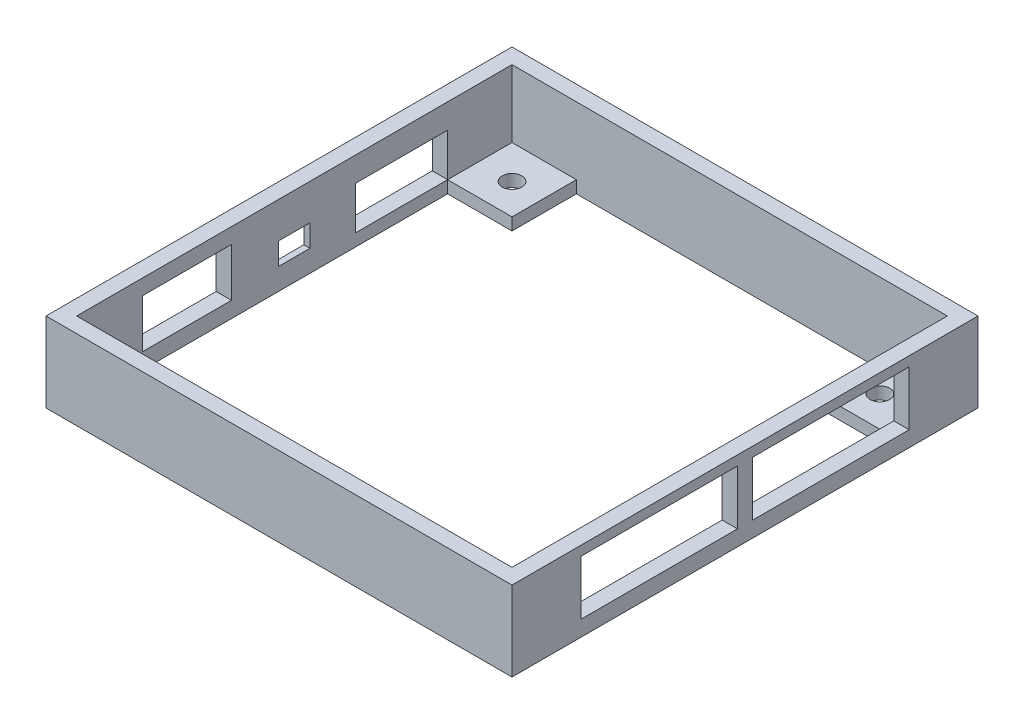
from build123d import *

# Parameters (mm, degrees)
SKETCH_1_W                  = 76
SKETCH_1_H                  = 76
EXTRUDE_1_DEPTH             = 13
SKETCH_2_W                  = 71
SKETCH_2_H                  = 71
CUT_EXTRUDE_1_DEPTH         = 11
SKETCH_3_R                  = 1.6
CUT_EXTRUDE_2_DEPTH         = 55.854352608
PATTERN_LINEAR_1_COUNT      = 2
PATTERN_LINEAR_1_PITCH      = 60
PATTERN_LINEAR_1_COUNT_DIR2 = 2
PATTERN_LINEAR_1_PITCH_DIR2 = 60
CUT_EXTRUDE_3_DEPTH         = 55.854352608
CUT_EXTRUDE_5_REACH         = 87.959
SKETCH_5_W                  = 14.5
SKETCH_5_H                  = 7.9
CUT_EXTRUDE_6_REACH         = 87.959
SKETCH_7_W                  = 25.542842713
SKETCH_7_H                  = 8.882842713
CUT_EXTRUDE_7_REACH         = 85.757
SKETCH_8_W                  = 5.1
SKETCH_8_H                  = 3.6
CUT_EXTRUDE_8_REACH         = 85.757
SKETCH_9_W                  = 15
SKETCH_9_H                  = 7
CHAMFER_1_SIZE              = 1.5


with BuildPart() as part:
    # 草图1 → 凸台-拉伸1 (new body)
    with BuildSketch(Plane(origin=(0, 0, 0), x_dir=(1, 0, 0), z_dir=(0, 1, 0))):
        Rectangle(SKETCH_1_W, SKETCH_1_H)
    extrude(amount=EXTRUDE_1_DEPTH)

    # 草图2 → 切除-拉伸1 (cut)
    with BuildSketch(Plane(origin=(0, 13, 0), x_dir=(1, 0, 0), z_dir=(0, 1, 0))):
        Rectangle(SKETCH_2_W, SKETCH_2_H)
    extrude(amount=-CUT_EXTRUDE_1_DEPTH, mode=Mode.SUBTRACT)

    # 草图3 → 切除-拉伸2 (cut, through all)
    with BuildSketch(Plane(origin=(0, 2, 0), x_dir=(1, 0, 0), z_dir=(0, 1, 0))):
        with Locations(Location((-30, 30, 0), (0, 0, 270))):
            Circle(SKETCH_3_R)
    cut_extrude_2 = extrude(amount=-CUT_EXTRUDE_2_DEPTH, mode=Mode.SUBTRACT)

    # 阵列(线性)1: Cut-Extrude 2 2 × 2
    with Locations(*[(i * PATTERN_LINEAR_1_PITCH, 0, j * PATTERN_LINEAR_1_PITCH_DIR2) for i in range(PATTERN_LINEAR_1_COUNT) for j in range(PATTERN_LINEAR_1_COUNT_DIR2) if (i, j) != (0, 0)]):
        add(cut_extrude_2, mode=Mode.SUBTRACT)

    # 草图4 → 切除-拉伸3 (cut, through all)
    with BuildSketch(Plane(origin=(0, 2, 0), x_dir=(1, 0, 0), z_dir=(0, 1, 0))):
        Polygon((35.5, -25), (25, -25), (25, -35.5), (-25, -35.5), (-25, -25), (-35.5, -25), (-35.5, 25), (-25, 25), (-25, 35.5), (25, 35.5), (25, 25), (35.5, 25), align=None)
    extrude(amount=-CUT_EXTRUDE_3_DEPTH, mode=Mode.SUBTRACT)

    # 草图5 → 切除-拉伸5 (cut, up to next)
    with BuildSketch(Plane.ZY.offset(38), mode=Mode.PRIVATE) as cut_extrude_5_sk1:
        with Locations((17.50009652, 6.536156877)):
            Rectangle(SKETCH_5_W, SKETCH_5_H)
    cut_extrude_5_tool1 = extrude(cut_extrude_5_sk1.sketch, amount=-CUT_EXTRUDE_5_REACH, mode=Mode.PRIVATE) & part.part
    add(cut_extrude_5_tool1.solids().sort_by_distance((-38, 6.536157, 17.500097))[0], mode=Mode.SUBTRACT)

    # 草图7 → 切除-拉伸6 (cut, up to next)
    with BuildSketch(Plane(origin=(38, 0, 0), x_dir=(0, 0, -1), z_dir=(1, 0, 0)), mode=Mode.PRIVATE) as cut_extrude_6_sk1:
        with Locations((13.99984252, 6.98615625)):
            Rectangle(SKETCH_7_W, SKETCH_7_H)
    cut_extrude_6_tool1 = extrude(cut_extrude_6_sk1.sketch, amount=-CUT_EXTRUDE_6_REACH, mode=Mode.PRIVATE) & part.part
    # 草图7 → 切除-拉伸6 (cut, up to next)
    with BuildSketch(Plane(origin=(38, 0, 0), x_dir=(0, 0, -1), z_dir=(1, 0, 0)), mode=Mode.PRIVATE) as cut_extrude_6_sk2:
        with Locations((-14.000215901, 6.98615625)):
            Rectangle(SKETCH_7_W, SKETCH_7_H)
    cut_extrude_6_tool2 = extrude(cut_extrude_6_sk2.sketch, amount=-CUT_EXTRUDE_6_REACH, mode=Mode.PRIVATE) & part.part
    add(cut_extrude_6_tool1.solids().sort_by_distance((38, 6.986156, -13.999843))[0], mode=Mode.SUBTRACT)
    add(cut_extrude_6_tool2.solids().sort_by_distance((38, 6.986156, 14.000216))[0], mode=Mode.SUBTRACT)

    # 草图8 → 切除-拉伸7 (cut, up to next)
    with BuildSketch(Plane(origin=(-35.5, 0, 0), x_dir=(0, 0, -1), z_dir=(1, 0, 0)), mode=Mode.PRIVATE) as cut_extrude_7_sk1:
        with Locations((-3.556e-05, 5.336156974)):
            Rectangle(SKETCH_8_W, SKETCH_8_H)
    cut_extrude_7_tool1 = extrude(cut_extrude_7_sk1.sketch, amount=-CUT_EXTRUDE_7_REACH, mode=Mode.PRIVATE) & part.part
    add(cut_extrude_7_tool1.solids().sort_by_distance((-35.5, 5.336157, 3.6e-05))[0], mode=Mode.SUBTRACT)

    # 草图9 → 切除-拉伸8 (cut, up to next)
    with BuildSketch(Plane(origin=(-35.5, 0, 0), x_dir=(0, 0, -1), z_dir=(1, 0, 0)), mode=Mode.PRIVATE) as cut_extrude_8_sk1:
        with Locations((17.5, 5.5)):
            Rectangle(SKETCH_9_W, SKETCH_9_H)
    cut_extrude_8_tool1 = extrude(cut_extrude_8_sk1.sketch, amount=-CUT_EXTRUDE_8_REACH, mode=Mode.PRIVATE) & part.part
    add(cut_extrude_8_tool1.solids().sort_by_distance((-35.5, 5.5, -17.5))[0], mode=Mode.SUBTRACT)

    # 倒角1
    chamfer_1_edges = [part.edges().sort_by_distance(p)[0] for p in [
        (-38, 5.336156974, -2.54996444),
        (-38, 3.536156974, 3.556e-05),
        (-38, 5.336156974, 2.55003556),
        (-38, 7.136156974, 3.556e-05),
    ]]
    chamfer(chamfer_1_edges, length=CHAMFER_1_SIZE)


solid = part.part
